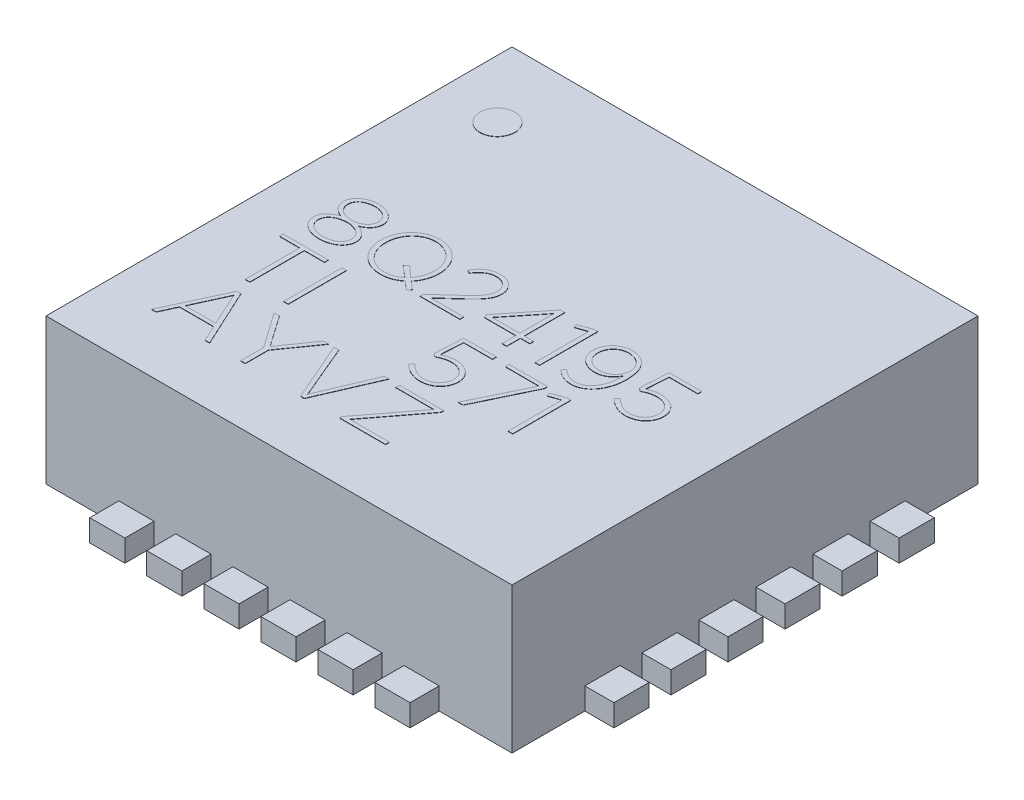
from build123d import *

# Parameters (mm, degrees)
SKETCH1_W           = 4.064
SKETCH1_H           = 4.064
BOSS_EXTRUDE1_DEPTH = 1.27
SKETCH2_W           = 0.306916667
SKETCH2_H           = 0.1905
SKETCH2_W_2         = 0.306916666
BOSS_EXTRUDE2_DEPTH = 0.254
CIRPATTERN1_COUNT   = 4
SKETCH4_R           = 0.1524
SKETCH4_W           = 0.040105263
SKETCH4_H           = 0.508
BOSS_EXTRUDE3_DEPTH = 0.00254


with BuildPart() as part:
    # Sketch1 → Boss-Extrude1 (new body)
    with BuildSketch(Plane(origin=(0, 0, 0), x_dir=(1, 0, 0), z_dir=(0, 1, 0))):
        Rectangle(SKETCH1_W, SKETCH1_H)
    extrude(amount=BOSS_EXTRUDE1_DEPTH)

    # Sketch2 → Boss-Extrude2 (add)
    with BuildSketch(Plane.XY.offset(2.032)):
        with Locations((-1.243541667, 0.09525)):
            Rectangle(SKETCH2_W, SKETCH2_H)
        with Locations((-0.746125, 0.09525)):
            Rectangle(SKETCH2_W_2, SKETCH2_H)
        with Locations((-0.248708334, 0.09525)):
            Rectangle(SKETCH2_W, SKETCH2_H)
        with Locations((0.248708334, 0.09525)):
            Rectangle(SKETCH2_W, SKETCH2_H)
        with Locations((0.746125, 0.09525)):
            Rectangle(SKETCH2_W_2, SKETCH2_H)
        with Locations((1.243541667, 0.09525)):
            Rectangle(SKETCH2_W, SKETCH2_H)
    boss_extrude2 = extrude(amount=BOSS_EXTRUDE2_DEPTH)

    # CirPattern1: Boss-Extrude2 ×4 about axis
    cirpattern1_axis = Axis((0, 0, 0), (0, 1, 0))
    for i in range(1, CIRPATTERN1_COUNT):
        add(boss_extrude2.rotate(cirpattern1_axis, i * 360 / CIRPATTERN1_COUNT))

    # Sketch4 → Boss-Extrude3 (add)
    # profile 1 of 17: a face of its own
    with BuildSketch(Plane(origin=(0, 1.27, 0), x_dir=(1, 0, 0), z_dir=(0, 1, 0))):
        with Locations(Location((-1.524, 1.397, 0), (0, 0, 270))):
            Circle(SKETCH4_R)
    # profile 2 of 17: a face of its own
    with BuildSketch(Plane(origin=(0, 1.27, 0), x_dir=(1, 0, 0), z_dir=(0, 1, 0))):
        with BuildLine():
            add(Edge.make_bspline(
                [(-1.423736842, -0.260684211), (-1.430217677, -0.26057708), (-1.443001851, -0.260365753), (-1.461845793, -0.258293011), (-1.480035947, -0.255093649), (-1.49747682, -0.250636225), (-1.513952921, -0.244903404), (-1.529361644, -0.238070717), (-1.543745325, -0.230384087), (-1.556919764, -0.221592846), (-1.568901469, -0.21188937), (-1.579510899, -0.201143912), (-1.588847464, -0.189563075), (-1.596732267, -0.177070803), (-1.603065091, -0.16377224), (-1.607536203, -0.149682309), (-1.610360564, -0.134910402), (-1.61071469, -0.12481958), (-1.610894737, -0.119689145)],
                knots=[0, 0, 0, 0, 1.192967604, 2.353262652, 3.486248597, 4.591715495, 5.664181549, 6.694533722, 7.692695552, 8.663453221, 9.606576922, 10.526764091, 11.438809736, 12.340523847, 13.240938182, 14.143085136, 15.05589643, 16, 16, 16, 16], degree=3))
            Line((-1.610894737, -0.119689145), (-1.610894737, -0.118226974))
            add(Edge.make_bspline(
                [(-1.610894737, -0.118226974), (-1.610813232, -0.114563141), (-1.610653206, -0.107369563), (-1.608825481, -0.096829022), (-1.606342987, -0.086656264), (-1.602445045, -0.076987385), (-1.597777459, -0.06768054), (-1.592146206, -0.058835412), (-1.586065506, -0.050190355), (-1.578973293, -0.042172116), (-1.571238469, -0.034472338), (-1.562650296, -0.027379175), (-1.553554557, -0.020450602), (-1.540154728, -0.012166679), (-1.522340606, -0.002644683), (-1.507054993, 0.002863842), (-1.499351974, 0.005639803)],
                knots=[0, 0, 0, 0, 0.862348318, 1.693137031, 2.514884982, 3.325335474, 4.14347205, 4.965220001, 5.793940509, 6.631264931, 7.483999692, 8.363157993, 9.254064526, 10.175823288, 12.07284769, 14, 14, 14, 14], degree=3))
            add(Edge.make_bspline(
                [(-1.499351974, 0.005639803), (-1.505748685, 0.00829491), (-1.518586701, 0.013623633), (-1.536656792, 0.023922639), (-1.553154695, 0.036137916), (-1.565435303, 0.047680777), (-1.574073524, 0.057790873), (-1.579764999, 0.065947331), (-1.584927943, 0.074552605), (-1.58943134, 0.083637715), (-1.593178821, 0.093244255), (-1.595582058, 0.103445354), (-1.59725972, 0.114098517), (-1.597436043, 0.121388044), (-1.597526316, 0.125120066)],
                knots=[0, 0, 0, 0, 1.51255183, 3.035648337, 4.531441085, 5.989848776, 6.707803045, 7.433934367, 8.160703137, 8.899047839, 9.647940023, 10.408185517, 11.185038218, 12, 12, 12, 12], degree=3))
            Line((-1.597526316, 0.125120066), (-1.597526316, 0.126582237))
            add(Edge.make_bspline(
                [(-1.597526316, 0.126582237), (-1.597343596, 0.131503545), (-1.596984347, 0.141179391), (-1.59420389, 0.155320205), (-1.589572943, 0.168754397), (-1.583028222, 0.181352575), (-1.575046676, 0.193181991), (-1.565800413, 0.204167549), (-1.555443089, 0.214348674), (-1.543852372, 0.223555765), (-1.53127227, 0.231876646), (-1.517718908, 0.239183623), (-1.503341557, 0.245595721), (-1.488170803, 0.250940497), (-1.472498786, 0.255393957), (-1.456407246, 0.258345879), (-1.440148873, 0.260330557), (-1.429208443, 0.260566306), (-1.423736842, 0.260684211)],
                knots=[0, 0, 0, 0, 0.972639934, 1.912319557, 2.837590777, 3.773556186, 4.711039378, 5.654167378, 6.608311004, 7.578071928, 8.576652838, 9.587028791, 10.619421191, 11.686352778, 12.765320507, 13.837348047, 14.918400104, 16, 16, 16, 16], degree=3))
            add(Edge.make_bspline(
                [(-1.423736842, 0.260684211), (-1.418265239, 0.260566309), (-1.407324805, 0.260330566), (-1.391066464, 0.258345843), (-1.374974804, 0.255394094), (-1.359303236, 0.250939984), (-1.344130837, 0.245597584), (-1.329759376, 0.239176979), (-1.316210318, 0.231914485), (-1.303706915, 0.223486382), (-1.292033264, 0.214389639), (-1.281677671, 0.204161823), (-1.272425843, 0.193183507), (-1.264445773, 0.181352171), (-1.257900659, 0.168754504), (-1.253269817, 0.155320176), (-1.250489331, 0.141179398), (-1.250130087, 0.131503548), (-1.249947368, 0.126582237)],
                knots=[0, 0, 0, 0, 1.081623568, 2.162699283, 3.234750286, 4.313741628, 5.380696565, 6.41311156, 7.423509625, 8.416377007, 9.39154437, 10.345708878, 11.288857519, 12.226361228, 13.162347121, 14.087638591, 15.027338779, 16, 16, 16, 16], degree=3))
            Line((-1.249947368, 0.126582237), (-1.249947368, 0.125120066))
            add(Edge.make_bspline(
                [(-1.249947368, 0.125120066), (-1.250037706, 0.121388085), (-1.250214158, 0.114098636), (-1.251890901, 0.103444909), (-1.254297504, 0.093245877), (-1.258032697, 0.08363179), (-1.262573011, 0.074590089), (-1.267571448, 0.065881), (-1.273418963, 0.057827842), (-1.28202137, 0.047670456), (-1.294331105, 0.036101951), (-1.310893603, 0.023987795), (-1.328902616, 0.013591272), (-1.341720899, 0.008287995), (-1.348121711, 0.005639803)],
                knots=[0, 0, 0, 0, 0.814958338, 1.591807756, 2.352050037, 3.100939056, 3.839280637, 4.562173205, 5.292712271, 6.010663505, 7.469065032, 8.970972537, 10.487454563, 12, 12, 12, 12], degree=3))
            add(Edge.make_bspline(
                [(-1.348121711, 0.005639803), (-1.340416923, 0.002868023), (-1.325156861, -0.00262175), (-1.307389317, -0.012174872), (-1.294018075, -0.020488738), (-1.28483604, -0.027308072), (-1.276341635, -0.034515016), (-1.268590855, -0.042159914), (-1.261534014, -0.050230772), (-1.25529525, -0.058767394), (-1.249828661, -0.067719137), (-1.24511464, -0.076979166), (-1.241269646, -0.086675367), (-1.238613321, -0.096810463), (-1.236830015, -0.107372136), (-1.23666367, -0.11456401), (-1.236578947, -0.118226974)],
                knots=[0, 0, 0, 0, 1.927751522, 3.818094814, 4.740140181, 5.637911092, 6.511079817, 7.36407972, 8.201664492, 9.035462003, 9.853153256, 10.671544216, 11.482246703, 12.30633652, 13.137383551, 14, 14, 14, 14], degree=3))
            Line((-1.236578947, -0.118226974), (-1.236578947, -0.119689145))
            add(Edge.make_bspline(
                [(-1.236578947, -0.119689145), (-1.23677398, -0.124816413), (-1.237157344, -0.134894768), (-1.239766607, -0.149716593), (-1.244448326, -0.163749447), (-1.250729535, -0.177074299), (-1.258629445, -0.189562129), (-1.267961913, -0.201144158), (-1.278572442, -0.211889343), (-1.290553912, -0.221592697), (-1.303728147, -0.23038474), (-1.318112937, -0.23806815), (-1.333547308, -0.244926866), (-1.350073672, -0.250616426), (-1.367508682, -0.255083113), (-1.385661014, -0.258303275), (-1.404472091, -0.260364051), (-1.417256094, -0.260576507), (-1.423736842, -0.260684211)],
                knots=[0, 0, 0, 0, 0.944069567, 1.855699311, 2.75979302, 3.660174925, 4.561856559, 5.473869356, 6.394023383, 7.337113116, 8.307835822, 9.305961701, 10.336276765, 11.414760185, 12.520187268, 13.646822104, 14.807075362, 16, 16, 16, 16], degree=3))
        make_face()
        with BuildLine():
            add(Edge.make_bspline(
                [(-1.423736842, -0.227263158), (-1.418161504, -0.227180457), (-1.407262929, -0.227018794), (-1.391394933, -0.225248844), (-1.376322432, -0.222718251), (-1.362177163, -0.218968398), (-1.348985653, -0.214211552), (-1.336770107, -0.208887057), (-1.325692513, -0.202625008), (-1.315614582, -0.195760937), (-1.30668217, -0.188169336), (-1.298823488, -0.180032332), (-1.292111091, -0.171357818), (-1.286564885, -0.162128525), (-1.282133633, -0.152507903), (-1.279010208, -0.142540642), (-1.277027088, -0.132265773), (-1.276799461, -0.125303189), (-1.276684211, -0.121777961)],
                knots=[0, 0, 0, 0, 1.330333603, 2.60051294, 3.806942895, 4.976101593, 6.088005536, 7.152045264, 8.152972394, 9.121140005, 10.058610309, 10.946126467, 11.817147525, 12.670869761, 13.511343182, 14.339273682, 15.159156879, 16, 16, 16, 16], degree=3))
            Line((-1.276684211, -0.121777961), (-1.276684211, -0.120315789))
            add(Edge.make_bspline(
                [(-1.276684211, -0.120315789), (-1.276833726, -0.116478114), (-1.277129566, -0.108884661), (-1.279218732, -0.097712642), (-1.282948472, -0.087101045), (-1.288001167, -0.077013134), (-1.294288422, -0.06757988), (-1.301552122, -0.058641055), (-1.310044612, -0.050568905), (-1.319525084, -0.043093799), (-1.32992054, -0.036371632), (-1.341207858, -0.030321475), (-1.353410534, -0.02528158), (-1.366368411, -0.021022392), (-1.379925429, -0.017531061), (-1.394080904, -0.015188848), (-1.408734249, -0.013676711), (-1.41868505, -0.013472231), (-1.423736842, -0.013368421)],
                knots=[0, 0, 0, 0, 0.912857224, 1.806233564, 2.691511623, 3.580423748, 4.483156269, 5.383454109, 6.314759265, 7.264153955, 8.251930542, 9.255995273, 10.306530482, 11.388173411, 12.498974, 13.633147632, 14.798403539, 16, 16, 16, 16], degree=3))
            add(Edge.make_bspline(
                [(-1.423736842, -0.013368421), (-1.428788584, -0.01347245), (-1.438739287, -0.013677362), (-1.453393347, -0.015186364), (-1.467579531, -0.017545571), (-1.481177872, -0.021008013), (-1.494142893, -0.025258584), (-1.506289046, -0.030348413), (-1.517554965, -0.036368179), (-1.527946337, -0.043096146), (-1.53743602, -0.050563113), (-1.545912849, -0.058676656), (-1.553301988, -0.067542225), (-1.559561657, -0.077021194), (-1.564660887, -0.087077795), (-1.568222732, -0.097735689), (-1.570352956, -0.108881585), (-1.570642925, -0.116477081), (-1.570789474, -0.120315789)],
                knots=[0, 0, 0, 0, 1.201371395, 2.366409042, 3.500370237, 4.618990472, 5.700430802, 6.743136508, 7.747013171, 8.734604742, 9.683821604, 10.614952321, 11.520360034, 12.422923468, 13.311669095, 14.194104754, 15.08731376, 16, 16, 16, 16], degree=3))
            Line((-1.570789474, -0.120315789), (-1.570789474, -0.121777961))
            add(Edge.make_bspline(
                [(-1.570789474, -0.121777961), (-1.57067714, -0.125304089), (-1.570455274, -0.13226845), (-1.568431643, -0.142520037), (-1.565475608, -0.152528058), (-1.561004907, -0.162126969), (-1.555463983, -0.171352904), (-1.548761253, -0.180073483), (-1.540793093, -0.188097611), (-1.531962919, -0.195798375), (-1.521862091, -0.202649509), (-1.510723205, -0.208858784), (-1.498490405, -0.214216181), (-1.485295837, -0.218967064), (-1.471151446, -0.222718628), (-1.456078696, -0.225248736), (-1.44021077, -0.227018823), (-1.429312186, -0.227180467), (-1.423736842, -0.227263158)],
                knots=[0, 0, 0, 0, 0.840619978, 1.660285594, 2.485532512, 3.325782887, 4.179278562, 5.050068468, 5.943126204, 6.874029178, 7.841939856, 8.849852749, 9.913610101, 11.025218967, 12.194067394, 13.400177186, 14.670019442, 16, 16, 16, 16], degree=3))
        make_face(mode=Mode.SUBTRACT)
        with BuildLine():
            add(Edge.make_bspline(
                [(-1.423736842, 0.020052632), (-1.419276765, 0.020159072), (-1.410437252, 0.020370028), (-1.397378242, 0.021866871), (-1.384671181, 0.024273688), (-1.372366501, 0.02758843), (-1.360638403, 0.031844603), (-1.349590376, 0.03691633), (-1.339211777, 0.042595981), (-1.329688522, 0.049215398), (-1.320984308, 0.056557798), (-1.313119909, 0.064527574), (-1.306396374, 0.073364119), (-1.300510966, 0.082712115), (-1.295769558, 0.092754483), (-1.292443786, 0.103365936), (-1.290371107, 0.114455612), (-1.290159912, 0.12201247), (-1.290052632, 0.125851151)],
                knots=[0, 0, 0, 0, 1.12947462, 2.238527834, 3.324523793, 4.402544155, 5.462455016, 6.480423197, 7.478998997, 8.45489483, 9.412251799, 10.360018837, 11.284153904, 12.218787277, 13.153628582, 14.087804342, 15.028655684, 16, 16, 16, 16], degree=3))
            Line((-1.290052632, 0.125851151), (-1.290052632, 0.127313322))
            add(Edge.make_bspline(
                [(-1.290052632, 0.127313322), (-1.290159704, 0.130909232), (-1.290371391, 0.138018524), (-1.292465474, 0.14843403), (-1.295676366, 0.158413148), (-1.30022534, 0.167865877), (-1.305893287, 0.176723011), (-1.312477307, 0.18501561), (-1.320087299, 0.192611506), (-1.328686679, 0.199458527), (-1.338100087, 0.205747908), (-1.348361883, 0.211314395), (-1.359529987, 0.215962493), (-1.371343068, 0.220023402), (-1.383798434, 0.223293248), (-1.396732236, 0.225502388), (-1.410085345, 0.22709581), (-1.419136514, 0.227206764), (-1.423736842, 0.227263158)],
                knots=[0, 0, 0, 0, 0.929266001, 1.837205292, 2.737247748, 3.635621243, 4.54262191, 5.452702991, 6.369798801, 7.317861578, 8.292088543, 9.295561314, 10.332744225, 11.417933902, 12.525505555, 13.659781721, 14.810565708, 16, 16, 16, 16], degree=3))
            add(Edge.make_bspline(
                [(-1.423736842, 0.227263158), (-1.428337122, 0.227206551), (-1.437388197, 0.227095177), (-1.450741993, 0.22550481), (-1.463706489, 0.223278685), (-1.476202848, 0.220037079), (-1.488025962, 0.215990479), (-1.499155601, 0.211260042), (-1.509455506, 0.205775346), (-1.518888328, 0.199494732), (-1.527391526, 0.192540424), (-1.535106318, 0.185057259), (-1.541681664, 0.176717865), (-1.547344835, 0.167864413), (-1.55193167, 0.158433586), (-1.554975978, 0.148412603), (-1.557111157, 0.138021351), (-1.557316958, 0.130910181), (-1.557421053, 0.127313322)],
                knots=[0, 0, 0, 0, 1.189062478, 2.339486733, 3.473408327, 4.589349186, 5.674199634, 6.702776354, 7.713864404, 8.687786829, 9.628556027, 10.551753839, 11.461550431, 12.368267572, 13.266360238, 14.163369014, 15.071024485, 16, 16, 16, 16], degree=3))
            Line((-1.557421053, 0.127313322), (-1.557421053, 0.125851151))
            add(Edge.make_bspline(
                [(-1.557421053, 0.125851151), (-1.557328733, 0.122009272), (-1.557146838, 0.114439752), (-1.5548582, 0.103400163), (-1.551746549, 0.092730659), (-1.546943106, 0.082721651), (-1.541097329, 0.073322383), (-1.534235642, 0.064598338), (-1.526494802, 0.056522512), (-1.517769687, 0.049182181), (-1.508186464, 0.042663555), (-1.497847663, 0.036850072), (-1.486775702, 0.031902087), (-1.475083418, 0.027560362), (-1.462800362, 0.024279019), (-1.450096028, 0.021865412), (-1.437036281, 0.020370404), (-1.428196868, 0.020159198), (-1.423736842, 0.020052632)],
                knots=[0, 0, 0, 0, 0.971491902, 1.914096394, 2.845788487, 3.780771832, 4.715547213, 5.645233868, 6.587012962, 7.544515391, 8.527822927, 9.51885083, 10.545000554, 11.596786924, 12.674971079, 13.761132045, 14.870353767, 16, 16, 16, 16], degree=3))
        make_face(mode=Mode.SUBTRACT)
    # profile 3 of 17: a face of its own
    with BuildSketch(Plane(origin=(0, 1.27, 0), x_dir=(1, 0, 0), z_dir=(0, 1, 0))):
        with BuildLine():
            add(Edge.make_bspline(
                [(-0.726594572, -0.202928454), (-0.732081662, -0.2073596), (-0.743065608, -0.216229779), (-0.761067116, -0.227491836), (-0.779929913, -0.237537601), (-0.799883862, -0.245885724), (-0.820894501, -0.252482714), (-0.842899441, -0.257313024), (-0.865982647, -0.260161978), (-0.881715983, -0.260507957), (-0.889731086, -0.260684211)],
                knots=[0, 0, 0, 0, 0.95691653, 1.915536321, 2.877681338, 3.856589002, 4.847837564, 5.864099018, 6.911898643, 8, 8, 8, 8], degree=3))
            add(Edge.make_bspline(
                [(-0.889731086, -0.260684211), (-0.899145794, -0.260429652), (-0.917574406, -0.259931373), (-0.944491402, -0.255840665), (-0.970057829, -0.249328076), (-0.994114772, -0.239969395), (-1.016501804, -0.228323578), (-1.037394392, -0.215003999), (-1.056562326, -0.199806431), (-1.074027318, -0.182846961), (-1.089737289, -0.164312752), (-1.103584805, -0.144317067), (-1.115375843, -0.122845513), (-1.125456385, -0.10025574), (-1.133241879, -0.076512802), (-1.138889412, -0.052050728), (-1.14232593, -0.026938756), (-1.142774046, -0.010002119), (-1.143, -0.001462171)],
                knots=[0, 0, 0, 0, 1.117460472, 2.187348085, 3.225110401, 4.244622457, 5.244885452, 6.217313992, 7.182519102, 8.144345375, 9.103467135, 10.063265737, 11.027328158, 12.008260535, 12.99656078, 13.989329521, 14.986161071, 16, 16, 16, 16], degree=3))
            Line((-1.143, -0.001462171), (-1.143, 0))
            add(Edge.make_bspline(
                [(-1.143, 0), (-1.142781841, 0.008540939), (-1.142348181, 0.025518733), (-1.138784032, 0.050662413), (-1.133032818, 0.07524162), (-1.125003388, 0.099082641), (-1.114884937, 0.121940551), (-1.102853222, 0.143510124), (-1.088990714, 0.163701789), (-1.073294772, 0.18241677), (-1.05585935, 0.19962779), (-1.036532322, 0.214911796), (-1.015529676, 0.228326888), (-0.992934503, 0.239848283), (-0.968789904, 0.249200719), (-0.943149467, 0.25587334), (-0.916144027, 0.259916797), (-0.897682725, 0.260425044), (-0.888268914, 0.260684211)],
                knots=[0, 0, 0, 0, 1.00868156, 2.005070874, 2.993722382, 3.987400104, 4.972529166, 5.942874247, 6.901176761, 7.861709682, 8.824388773, 9.790462053, 10.767088875, 11.764046771, 12.782209445, 13.819710371, 14.888224016, 16, 16, 16, 16], degree=3))
            add(Edge.make_bspline(
                [(-0.888268914, 0.260684211), (-0.878959714, 0.260423096), (-0.860672163, 0.259910147), (-0.833906147, 0.255879451), (-0.808419746, 0.249162594), (-0.784334205, 0.239850817), (-0.761736598, 0.228330029), (-0.740765285, 0.214908832), (-0.72144248, 0.199740156), (-0.703977568, 0.182737035), (-0.68825791, 0.164211257), (-0.674429557, 0.144206307), (-0.662562208, 0.122747998), (-0.652728888, 0.100022069), (-0.644731838, 0.076362142), (-0.6391092, 0.051910208), (-0.635673246, 0.02683493), (-0.635225677, 0.009897885), (-0.635, 0.00135773)],
                knots=[0, 0, 0, 0, 1.105207404, 2.17113555, 3.20607169, 4.229564562, 5.231741648, 6.213481224, 7.182047549, 8.143990697, 9.103229002, 10.063144233, 11.027323801, 12.01049879, 13.000223961, 13.989085197, 14.986037876, 16, 16, 16, 16], degree=3))
            add(Edge.make_bspline(
                [(-0.635, 0.00135773), (-0.634791118, 0.001114035), (-0.634373355, 0.000626645), (-0.634791118, 0.000139254), (-0.635, -0.000104441)],
                knots=[0, 0, 0, 0, 1, 2, 2, 2, 2], degree=3))
            add(Edge.make_bspline(
                [(-0.635, -0.000104441), (-0.63518736, -0.008435902), (-0.635558825, -0.024954077), (-0.638938546, -0.049382006), (-0.644258982, -0.073216825), (-0.651665767, -0.096357851), (-0.661046643, -0.118655844), (-0.672477368, -0.139813838), (-0.685827712, -0.159801674), (-0.696216995, -0.171971667), (-0.701424342, -0.178071546)],
                knots=[0, 0, 0, 0, 1.028814904, 2.03975557, 3.040397136, 4.042839456, 5.037352667, 6.024547828, 7.009858051, 8, 8, 8, 8], degree=3))
            Line((-0.701424342, -0.178071546), (-0.629255757, -0.238542763))
            Line((-0.629255757, -0.238542763), (-0.655888158, -0.267368421))
            Line((-0.655888158, -0.267368421), (-0.726594572, -0.202928454))
        make_face()
        with BuildLine():
            add(Edge.make_bspline(
                [(-0.888268914, -0.227263158), (-0.881787166, -0.227090397), (-0.86906103, -0.226751202), (-0.850312159, -0.224436284), (-0.832308524, -0.220466128), (-0.815063424, -0.214903831), (-0.798620484, -0.20798661), (-0.783026242, -0.199835663), (-0.768321342, -0.19045587), (-0.759293601, -0.183236676), (-0.754793586, -0.179638158)],
                knots=[0, 0, 0, 0, 1.075116983, 2.110863481, 3.128091548, 4.128893241, 5.112401198, 6.083625486, 7.044753704, 8, 8, 8, 8], degree=3))
            Line((-0.754793586, -0.179638158), (-0.852445724, -0.095981086))
            Line((-0.852445724, -0.095981086), (-0.825813322, -0.066424342))
            Line((-0.825813322, -0.066424342), (-0.729623355, -0.154363487))
            add(Edge.make_bspline(
                [(-0.729623355, -0.154363487), (-0.725438625, -0.149222881), (-0.717030947, -0.138894722), (-0.706414657, -0.121873782), (-0.696978228, -0.103902358), (-0.689221037, -0.084820424), (-0.682962856, -0.064877695), (-0.678294151, -0.044288338), (-0.675695019, -0.023043825), (-0.675303324, -0.008710056), (-0.675105263, -0.001462171)],
                knots=[0, 0, 0, 0, 0.959237174, 1.927234446, 2.899281412, 3.896530908, 4.906032444, 5.923861561, 6.950198441, 8, 8, 8, 8], degree=3))
            Line((-0.675105263, -0.001462171), (-0.675105263, 0))
            add(Edge.make_bspline(
                [(-0.675105263, 0), (-0.675308753, 0.007704097), (-0.675711796, 0.022963271), (-0.678842875, 0.045476189), (-0.68381163, 0.067355138), (-0.690971459, 0.088349465), (-0.699676785, 0.108405934), (-0.710091039, 0.127201225), (-0.72197075, 0.144714174), (-0.735517017, 0.160709892), (-0.750421113, 0.175320195), (-0.766694438, 0.188439286), (-0.78454276, 0.199709143), (-0.803493895, 0.209562655), (-0.823645517, 0.21756179), (-0.844886827, 0.223183744), (-0.867026244, 0.226598139), (-0.882094741, 0.227039492), (-0.889731086, 0.227263158)],
                knots=[0, 0, 0, 0, 1.061530303, 2.102527649, 3.126824791, 4.149547232, 5.15515158, 6.136678453, 7.106915779, 8.067194349, 9.02067536, 9.97988636, 10.942260631, 11.925170547, 12.920476076, 13.923788185, 14.947826792, 16, 16, 16, 16], degree=3))
            add(Edge.make_bspline(
                [(-0.889731086, 0.227263158), (-0.897366237, 0.227030987), (-0.912392791, 0.226574058), (-0.934468404, 0.223301064), (-0.955585529, 0.217751927), (-0.975637147, 0.209970613), (-0.99454907, 0.200404449), (-1.012125859, 0.188977763), (-1.028450217, 0.176066147), (-1.043316607, 0.161465174), (-1.056727889, 0.145452517), (-1.068542567, 0.128039581), (-1.078839017, 0.109340594), (-1.087450901, 0.089439615), (-1.094395541, 0.068555842), (-1.099232329, 0.04682272), (-1.102430777, 0.02439504), (-1.102738856, 0.009167157), (-1.102894737, 0.001462171)],
                knots=[0, 0, 0, 0, 1.057754835, 2.08174119, 3.084475534, 4.077063908, 5.056495456, 6.015859576, 6.977150046, 7.935689135, 8.897959471, 9.866640835, 10.846820482, 11.851409596, 12.867354005, 13.891306273, 14.9330456, 16, 16, 16, 16], degree=3))
            Line((-1.102894737, 0.001462171), (-1.102894737, 0))
            add(Edge.make_bspline(
                [(-1.102894737, 0), (-1.102690237, -0.007703735), (-1.102285193, -0.022962193), (-1.099168821, -0.045480374), (-1.09414777, -0.067328961), (-1.08719105, -0.088399014), (-1.078287669, -0.108375071), (-1.067926804, -0.12721195), (-1.056012345, -0.144671279), (-1.042595788, -0.160780969), (-1.027577222, -0.175286236), (-1.011281068, -0.188432742), (-0.993486144, -0.199821592), (-0.974526077, -0.209687411), (-0.954330409, -0.217533872), (-0.9331164, -0.223192275), (-0.910972916, -0.22659592), (-0.895904977, -0.227038745), (-0.888268914, -0.227263158)],
                knots=[0, 0, 0, 0, 1.061423812, 2.102316726, 3.126511111, 4.147610346, 5.155046497, 6.136474904, 7.106614896, 8.06371144, 9.020531346, 9.97964612, 10.944515933, 11.927327245, 12.920785011, 13.923996468, 14.947932345, 16, 16, 16, 16], degree=3))
        make_face(mode=Mode.SUBTRACT)
    # profile 4 of 17: a face of its own
    with BuildSketch(Plane(origin=(0, 1.27, 0), x_dir=(1, 0, 0), z_dir=(0, 1, 0))):
        with BuildLine():
            Line((-0.547583059, -0.225696546), (-0.359171875, -0.054726974))
            add(Edge.make_bspline(
                [(-0.359171875, -0.054726974), (-0.354167554, -0.05015925), (-0.344471458, -0.04130908), (-0.330853265, -0.028040969), (-0.318372898, -0.015486013), (-0.307044923, -0.003581903), (-0.296840854, 0.007879037), (-0.287650893, 0.01890065), (-0.279476169, 0.029605583), (-0.272176967, 0.039916582), (-0.266074837, 0.050111809), (-0.260609258, 0.059912813), (-0.256351305, 0.069659434), (-0.251867128, 0.082354322), (-0.248168222, 0.098631734), (-0.247601425, 0.111869278), (-0.247315789, 0.118540296)],
                knots=[0, 0, 0, 0, 1.339194723, 2.594749812, 3.757711961, 4.838337959, 5.842414235, 6.790454929, 7.674069491, 8.504473408, 9.285750938, 10.021678275, 10.721083763, 11.384883482, 12.682120271, 14, 14, 14, 14], degree=3))
            add(Edge.make_bspline(
                [(-0.247315789, 0.118540296), (-0.247457629, 0.122547422), (-0.247737602, 0.130456963), (-0.249306389, 0.142062058), (-0.25248643, 0.153036457), (-0.256495248, 0.163497166), (-0.261628683, 0.173253453), (-0.267519317, 0.182295002), (-0.274081794, 0.190632276), (-0.28157812, 0.198010223), (-0.289621675, 0.204775039), (-0.298458186, 0.21063879), (-0.307987742, 0.215647798), (-0.318109463, 0.219793217), (-0.328588766, 0.22311068), (-0.339336386, 0.225582088), (-0.350296182, 0.226902882), (-0.357671814, 0.227142947), (-0.361365132, 0.227263158)],
                knots=[0, 0, 0, 0, 1.094117954, 2.159645146, 3.185460996, 4.205275291, 5.212441618, 6.187501823, 7.147540828, 8.101542978, 9.052844513, 10.012036881, 10.989547397, 11.986443602, 12.993072009, 13.986521247, 14.991758693, 16, 16, 16, 16], degree=3))
            add(Edge.make_bspline(
                [(-0.361365132, 0.227263158), (-0.365334983, 0.227163202), (-0.373114167, 0.226967331), (-0.384588136, 0.226009149), (-0.395516902, 0.223929896), (-0.40609463, 0.221380428), (-0.416148558, 0.217883013), (-0.425902313, 0.213864171), (-0.435022997, 0.208796465), (-0.446869673, 0.201097551), (-0.46108366, 0.189438603), (-0.477709209, 0.173301019), (-0.494089334, 0.1545228), (-0.504143499, 0.140594368), (-0.50935773, 0.133370888)],
                knots=[0, 0, 0, 0, 0.779588061, 1.527653664, 2.256907532, 2.961369613, 3.661608841, 4.344524681, 5.029591551, 5.706323921, 7.116275394, 8.629062788, 10.251784821, 12, 12, 12, 12], degree=3))
            Line((-0.50935773, 0.133370888), (-0.537452303, 0.15217023))
            add(Edge.make_bspline(
                [(-0.537452303, 0.15217023), (-0.531923555, 0.16022328), (-0.521226306, 0.175804651), (-0.506495165, 0.193902892), (-0.494298699, 0.206950925), (-0.484697599, 0.215727617), (-0.474791251, 0.223940604), (-0.464306805, 0.231354603), (-0.453345106, 0.238079073), (-0.441764469, 0.243926283), (-0.42966037, 0.249102113), (-0.416818165, 0.253253091), (-0.403288578, 0.25662594), (-0.388906603, 0.259037113), (-0.373609147, 0.260346183), (-0.363108184, 0.260569437), (-0.357709704, 0.260684211)],
                knots=[0, 0, 0, 0, 1.85858161, 3.596059891, 4.435023373, 5.255574922, 6.07000447, 6.882599229, 7.697352134, 8.515197398, 9.349543371, 10.200224823, 11.080852807, 12.001285025, 12.972473097, 14, 14, 14, 14], degree=3))
            add(Edge.make_bspline(
                [(-0.357709704, 0.260684211), (-0.352412072, 0.260573169), (-0.341952474, 0.260353928), (-0.326594655, 0.258338546), (-0.31188924, 0.254968069), (-0.297844823, 0.250402976), (-0.284647163, 0.24451584), (-0.272193258, 0.237758565), (-0.260776895, 0.229763449), (-0.250308988, 0.220744913), (-0.240814157, 0.210858637), (-0.232373131, 0.200066931), (-0.22495966, 0.188508646), (-0.218690267, 0.176114581), (-0.213523655, 0.163106464), (-0.209886606, 0.149438535), (-0.207609481, 0.135222898), (-0.207344955, 0.125546538), (-0.207210526, 0.120629112)],
                knots=[0, 0, 0, 0, 1.108687071, 2.188981991, 3.235661581, 4.263598658, 5.275205626, 6.257074869, 7.225543959, 8.186828603, 9.145623371, 10.09040979, 11.050754573, 12.015569309, 12.994105717, 13.97532554, 14.97108155, 16, 16, 16, 16], degree=3))
            Line((-0.207210526, 0.120629112), (-0.207210526, 0.119271382))
            add(Edge.make_bspline(
                [(-0.207210526, 0.119271382), (-0.207281352, 0.114950955), (-0.207421084, 0.106427193), (-0.208812689, 0.093853123), (-0.211122077, 0.081711465), (-0.21427592, 0.069905382), (-0.218359128, 0.05827753), (-0.223673562, 0.046823703), (-0.229803399, 0.03524402), (-0.237219422, 0.023796479), (-0.245488827, 0.012137762), (-0.254857189, 0.000339623), (-0.265139875, -0.011772135), (-0.276672164, -0.024042457), (-0.289269297, -0.036759541), (-0.302885873, -0.05033612), (-0.317757242, -0.064536516), (-0.328141964, -0.074199563), (-0.333479441, -0.079166118)],
                knots=[0, 0, 0, 0, 0.853502812, 1.683874055, 2.496122363, 3.293789465, 4.096690329, 4.927944536, 5.786671486, 6.683649689, 7.620930688, 8.61048053, 9.659622535, 10.759698795, 11.936959445, 13.196886588, 14.559272518, 16, 16, 16, 16], degree=3))
            Line((-0.333479441, -0.079166118), (-0.487947368, -0.220578947))
            Line((-0.487947368, -0.220578947), (-0.200526316, -0.220578947))
            Line((-0.200526316, -0.220578947), (-0.200526316, -0.254))
            Line((-0.200526316, -0.254), (-0.547583059, -0.254))
            Line((-0.547583059, -0.254), (-0.547583059, -0.225696546))
        make_face()
    # profile 5 of 17: a face of its own
    with BuildSketch(Plane(origin=(0, 1.27, 0), x_dir=(1, 0, 0), z_dir=(0, 1, 0))):
        Polygon((0.167105263, -0.133684211), (-0.106529605, -0.133684211), (-0.119480263, -0.105380757), (0.169507401, 0.254), (0.207210526, 0.254), (0.207210526, -0.100263158), (0.289509868, -0.100263158), (0.289509868, -0.133684211), (0.207210526, -0.133684211), (0.207210526, -0.254), (0.167105263, -0.254), align=None)
        Polygon((0.167105263, -0.100263158), (0.167105263, 0.198646382), (-0.07404852, -0.100263158), align=None, mode=Mode.SUBTRACT)
    # profile 6 of 17: a face of its own
    with BuildSketch(Plane(origin=(0, 1.27, 0), x_dir=(1, 0, 0), z_dir=(0, 1, 0))):
        Polygon((0.454526316, 0.215043586), (0.357083059, 0.181831414), (0.346952303, 0.211388158), (0.463194901, 0.254), (0.494631579, 0.254), (0.494631579, -0.254), (0.454526316, -0.254), align=None)
    # profile 7 of 17: a face of its own
    with BuildSketch(Plane(origin=(0, 1.27, 0), x_dir=(1, 0, 0), z_dir=(0, 1, 0))):
        with BuildLine():
            add(Edge.make_bspline(
                [(0.774219572, -0.260684211), (0.766512619, -0.260468973), (0.751475797, -0.260049028), (0.729621174, -0.256620768), (0.709118324, -0.251166851), (0.690017596, -0.243258063), (0.672108782, -0.233568296), (0.654691167, -0.223051279), (0.637938812, -0.211320434), (0.62729382, -0.202746), (0.621944901, -0.1984375)],
                knots=[0, 0, 0, 0, 1.09895189, 2.144134415, 3.147733063, 4.118893565, 5.085318409, 6.050364033, 7.020342788, 8, 8, 8, 8], degree=3))
            Line((0.621944901, -0.1984375), (0.645757401, -0.169507401))
            add(Edge.make_bspline(
                [(0.645757401, -0.169507401), (0.651091029, -0.174110299), (0.661423804, -0.18302744), (0.677483759, -0.194739922), (0.693272353, -0.204719034), (0.708941341, -0.213055502), (0.724878718, -0.219389579), (0.741158784, -0.223889355), (0.757898388, -0.226716099), (0.769230172, -0.227079637), (0.774950658, -0.227263158)],
                knots=[0, 0, 0, 0, 1.166672397, 2.260180855, 3.289015566, 4.25892832, 5.195982641, 6.123637376, 7.05277881, 8, 8, 8, 8], degree=3))
            add(Edge.make_bspline(
                [(0.774950658, -0.227263158), (0.781200124, -0.227019776), (0.793564006, -0.226538271), (0.811643292, -0.222776342), (0.828886695, -0.216643998), (0.845259871, -0.208129473), (0.86052172, -0.197321818), (0.874795375, -0.184685027), (0.887715986, -0.170053361), (0.899589389, -0.153680657), (0.910098606, -0.135508022), (0.919143247, -0.115629661), (0.927017805, -0.09424347), (0.933427414, -0.071258624), (0.938471605, -0.046880673), (0.941643368, -0.02121469), (0.94316638, 0.005589537), (0.942707689, 0.023811589), (0.942473684, 0.03310773)],
                knots=[0, 0, 0, 0, 0.867952769, 1.717149156, 2.554185777, 3.404594082, 4.272991703, 5.146857209, 6.048045, 6.979979854, 7.953339853, 8.959954231, 10.011501689, 11.117329598, 12.273003272, 13.467773553, 14.708162134, 16, 16, 16, 16], degree=3))
            add(Edge.make_bspline(
                [(0.942473684, 0.03310773), (0.938740439, 0.026515373), (0.931213067, 0.013223149), (0.919770939, -0.00218552), (0.909674741, -0.013863935), (0.901499847, -0.022160131), (0.892737214, -0.029867644), (0.88340891, -0.03702387), (0.873466378, -0.043467923), (0.863003672, -0.049374176), (0.851889143, -0.054486693), (0.840201082, -0.058859076), (0.827907544, -0.06250238), (0.814920692, -0.064917367), (0.801311929, -0.06656722), (0.792014466, -0.066749288), (0.787274671, -0.066842105)],
                knots=[0, 0, 0, 0, 1.633064954, 3.292762144, 4.128493712, 4.962198443, 5.802875112, 6.643987704, 7.495892772, 8.356589936, 9.23354678, 10.131819618, 11.046793933, 11.99526999, 12.977999713, 14, 14, 14, 14], degree=3))
            add(Edge.make_bspline(
                [(0.787274671, -0.066842105), (0.781104116, -0.066719946), (0.768962287, -0.066479573), (0.751159768, -0.06403729), (0.734060315, -0.060499943), (0.717853367, -0.055225961), (0.702595838, -0.048642642), (0.688372151, -0.040909814), (0.675164459, -0.032100838), (0.663205999, -0.022072959), (0.652370426, -0.011073878), (0.642833331, 0.000930974), (0.634443562, 0.013765452), (0.627434766, 0.027484301), (0.621863417, 0.041933427), (0.617935826, 0.056999813), (0.615426725, 0.072607402), (0.615108699, 0.083194883), (0.614947368, 0.088565789)],
                knots=[0, 0, 0, 0, 1.142854509, 2.248800132, 3.324407685, 4.375173688, 5.401084946, 6.400004354, 7.371653371, 8.338147944, 9.287105371, 10.228200474, 11.174852231, 12.124160507, 13.077908967, 14.038766695, 15.005088979, 16, 16, 16, 16], degree=3))
            Line((0.614947368, 0.088565789), (0.614947368, 0.090027961))
            add(Edge.make_bspline(
                [(0.614947368, 0.090027961), (0.615113474, 0.095780287), (0.615442116, 0.107161354), (0.617901897, 0.124000152), (0.622006926, 0.140358111), (0.627634808, 0.156202924), (0.634701049, 0.171334502), (0.643203347, 0.185486337), (0.65298684, 0.198620884), (0.663987088, 0.210770765), (0.676166065, 0.221881021), (0.689666376, 0.231577852), (0.704132758, 0.240214329), (0.719717333, 0.247537001), (0.736370668, 0.253381776), (0.753952662, 0.25768338), (0.772474125, 0.260223776), (0.785108299, 0.260528619), (0.791556743, 0.260684211)],
                knots=[0, 0, 0, 0, 1.007145394, 1.992652489, 2.973016653, 3.956466024, 4.932879082, 5.892725135, 6.842605771, 7.79652793, 8.75906163, 9.723678405, 10.702353905, 11.706024079, 12.733774052, 13.788088757, 14.871047239, 16, 16, 16, 16], degree=3))
            add(Edge.make_bspline(
                [(0.791556743, 0.260684211), (0.79821725, 0.260553591), (0.811214261, 0.260298706), (0.830092395, 0.257446802), (0.847884866, 0.253168841), (0.864425434, 0.246867156), (0.879938974, 0.239390597), (0.894239435, 0.23054128), (0.907570865, 0.220775136), (0.915464215, 0.21325203), (0.91939227, 0.209508224)],
                knots=[0, 0, 0, 0, 1.129461473, 2.203980053, 3.232843748, 4.229304981, 5.201707126, 6.15116916, 7.079946018, 8, 8, 8, 8], degree=3))
            add(Edge.make_bspline(
                [(0.91939227, 0.209508224), (0.924105626, 0.20449109), (0.933691695, 0.194287195), (0.943952922, 0.179821167), (0.951404385, 0.167218443), (0.956766531, 0.15706079), (0.961414159, 0.146070746), (0.965793467, 0.13451338), (0.969865487, 0.1222193), (0.973081401, 0.10905807), (0.976062034, 0.095140452), (0.978434245, 0.080392964), (0.980296058, 0.064818267), (0.981684789, 0.048343312), (0.98234798, 0.030954716), (0.982500785, 0.019043436), (0.982578947, 0.012950658)],
                knots=[0, 0, 0, 0, 1.36139999, 2.768828395, 3.497984668, 4.259254587, 5.040107438, 5.857909503, 6.705590199, 7.601394472, 8.537960698, 9.522405295, 10.556599683, 11.642158021, 12.793932454, 14, 14, 14, 14], degree=3))
            Line((0.982578947, 0.012950658), (0.982578947, 0.011488487))
            add(Edge.make_bspline(
                [(0.982578947, 0.011488487), (0.982390499, 0.001731121), (0.982020667, -0.017417781), (0.978755823, -0.045481062), (0.973777805, -0.072354901), (0.966357668, -0.097790821), (0.957454647, -0.121793319), (0.946925506, -0.144195497), (0.935074649, -0.164982827), (0.921811867, -0.18408304), (0.9071656, -0.201238072), (0.89133142, -0.21651948), (0.874248642, -0.22973442), (0.856057112, -0.24085192), (0.836828107, -0.24970688), (0.816708846, -0.25610362), (0.795709624, -0.259984295), (0.781442344, -0.26044897), (0.774219572, -0.260684211)],
                knots=[0, 0, 0, 0, 1.230334843, 2.414541162, 3.559109368, 4.673795971, 5.752078941, 6.78536801, 7.79245963, 8.767011231, 9.71389417, 10.633188142, 11.537882254, 12.4325779, 13.316791413, 14.201440982, 15.089484443, 16, 16, 16, 16], degree=3))
        make_face()
        with BuildLine():
            add(Edge.make_bspline(
                [(0.793645559, -0.033421053), (0.798978957, -0.033278446), (0.809409406, -0.032999551), (0.824672004, -0.030878062), (0.839100691, -0.027362037), (0.852643338, -0.022390613), (0.865280834, -0.016332881), (0.876964437, -0.009332759), (0.887755342, -0.00153585), (0.897582584, 0.007108397), (0.906308753, 0.016604559), (0.914037549, 0.026721534), (0.920616875, 0.037468773), (0.926012372, 0.048804634), (0.930465126, 0.060402607), (0.933413872, 0.07226842), (0.935444527, 0.084179411), (0.935674247, 0.09217795), (0.935789474, 0.096189967)],
                knots=[0, 0, 0, 0, 1.197747958, 2.342418122, 3.453882716, 4.5275646, 5.576905283, 6.597528683, 7.583002742, 8.563655548, 9.532134433, 10.475275837, 11.419486544, 12.356871777, 13.292297727, 14.20462154, 15.099449471, 16, 16, 16, 16], degree=3))
            Line((0.935789474, 0.096189967), (0.935789474, 0.097652138))
            add(Edge.make_bspline(
                [(0.935789474, 0.097652138), (0.935633215, 0.102080069), (0.935324057, 0.110840755), (0.933332503, 0.123784884), (0.929850812, 0.136281004), (0.925008845, 0.148289279), (0.919083387, 0.159715537), (0.912155702, 0.170506245), (0.904086019, 0.180404882), (0.895020981, 0.189557907), (0.885042782, 0.197934016), (0.87392839, 0.205268434), (0.861910083, 0.211746627), (0.848943048, 0.217273356), (0.835248753, 0.221732926), (0.820895164, 0.225030602), (0.805984872, 0.226899945), (0.795843851, 0.22714126), (0.790721217, 0.227263158)],
                knots=[0, 0, 0, 0, 0.980656696, 1.940234716, 2.892349928, 3.847301653, 4.802502339, 5.739196388, 6.682026122, 7.625202561, 8.588675414, 9.561633884, 10.568933392, 11.608641031, 12.678999484, 13.754455175, 14.865685777, 16, 16, 16, 16], degree=3))
            add(Edge.make_bspline(
                [(0.790721217, 0.227263158), (0.785596559, 0.227120438), (0.775581774, 0.226841531), (0.760939644, 0.224725232), (0.747110097, 0.221180105), (0.734133344, 0.216263311), (0.722091626, 0.210130224), (0.710872171, 0.203192639), (0.700672887, 0.195142393), (0.691360694, 0.186299096), (0.683089984, 0.1765451), (0.675867932, 0.166019978), (0.669520979, 0.154802033), (0.664404053, 0.142823786), (0.660168591, 0.130450531), (0.6572843, 0.117738366), (0.655429618, 0.104843475), (0.655178621, 0.096161442), (0.655052632, 0.091803454)],
                knots=[0, 0, 0, 0, 1.149457013, 2.246309, 3.310957911, 4.346707444, 5.352697443, 6.338750924, 7.301229249, 8.2624708, 9.215554207, 10.164500098, 11.122658651, 12.10210102, 13.08266389, 14.052718415, 15.022552806, 16, 16, 16, 16], degree=3))
            Line((0.655052632, 0.091803454), (0.655052632, 0.090341283))
            add(Edge.make_bspline(
                [(0.655052632, 0.090341283), (0.655172178, 0.085948742), (0.65540766, 0.077296374), (0.657299307, 0.064566981), (0.660604905, 0.05242001), (0.664919887, 0.040776571), (0.670634644, 0.029900474), (0.677341714, 0.019710205), (0.685087649, 0.010266106), (0.693910957, 0.001689538), (0.703661358, -0.006039938), (0.714254687, -0.012964507), (0.725675554, -0.018981882), (0.737799973, -0.024302752), (0.750771884, -0.028319053), (0.764435829, -0.031248102), (0.778801609, -0.033057716), (0.788627074, -0.033298215), (0.793645559, -0.033421053)],
                knots=[0, 0, 0, 0, 1.014744419, 1.998829498, 2.964728541, 3.919441268, 4.862114519, 5.796963762, 6.734267181, 7.678586545, 8.634653956, 9.605231474, 10.598480164, 11.614626604, 12.660307295, 13.730062824, 14.840599607, 16, 16, 16, 16], degree=3))
        make_face(mode=Mode.SUBTRACT)
    # profile 8 of 17: a face of its own
    with BuildSketch(Plane(origin=(0, 1.27, 0), x_dir=(1, 0, 0), z_dir=(0, 1, 0))):
        with BuildLine():
            add(Edge.make_bspline(
                [(1.246396382, -0.260684211), (1.237848045, -0.260409061), (1.220915334, -0.259864038), (1.195899316, -0.255307749), (1.171690275, -0.247871788), (1.148464605, -0.23755934), (1.126512315, -0.225127967), (1.105900611, -0.211354258), (1.086826764, -0.196290725), (1.075304566, -0.185166706), (1.069578125, -0.179638158)],
                knots=[0, 0, 0, 0, 1.027091986, 2.034483686, 3.045944865, 4.065436139, 5.082966719, 6.075467794, 7.043522885, 8, 8, 8, 8], degree=3))
            Line((1.069578125, -0.179638158), (1.096314967, -0.152901316))
            add(Edge.make_bspline(
                [(1.096314967, -0.152901316), (1.102076258, -0.158465315), (1.113397947, -0.1693993), (1.131577564, -0.183837229), (1.149975316, -0.196731205), (1.168846196, -0.207601588), (1.188086776, -0.21643022), (1.207775865, -0.222574069), (1.227716265, -0.226543786), (1.241156138, -0.227023784), (1.247858553, -0.227263158)],
                knots=[0, 0, 0, 0, 1.109179193, 2.17968211, 3.212685538, 4.219648281, 5.193340946, 6.139214123, 7.072032972, 8, 8, 8, 8], degree=3))
            add(Edge.make_bspline(
                [(1.247858553, -0.227263158), (1.25280728, -0.227137706), (1.26252826, -0.226891277), (1.276764363, -0.22510498), (1.290315171, -0.222105035), (1.303085125, -0.217768259), (1.31508747, -0.212475607), (1.326227501, -0.206196399), (1.336427347, -0.19892656), (1.345747731, -0.190783681), (1.354103167, -0.181727974), (1.361648657, -0.172055118), (1.368182282, -0.161587896), (1.373726975, -0.150448441), (1.378071549, -0.13863338), (1.38137215, -0.126381983), (1.38327325, -0.113656462), (1.383511235, -0.105038746), (1.383631579, -0.100680921)],
                knots=[0, 0, 0, 0, 1.145346535, 2.249849336, 3.315357495, 4.352544201, 5.366331399, 6.347897687, 7.307179358, 8.260859585, 9.207397063, 10.155202969, 11.096546173, 12.058801949, 13.030293121, 14.005687019, 14.991511462, 16, 16, 16, 16], degree=3))
            Line((1.383631579, -0.100680921), (1.383631579, -0.099323191))
            add(Edge.make_bspline(
                [(1.383631579, -0.099323191), (1.383512452, -0.095069543), (1.383277877, -0.086693565), (1.38138145, -0.074380903), (1.378090049, -0.062642551), (1.373711741, -0.051429322), (1.36817892, -0.040824406), (1.361425673, -0.03102102), (1.353812035, -0.021843274), (1.34504539, -0.013597811), (1.335422384, -0.006043226), (1.324836351, 0.000670453), (1.313259658, 0.006404411), (1.300882528, 0.011261378), (1.287810634, 0.015287033), (1.274065056, 0.018070863), (1.259739179, 0.019786554), (1.249987084, 0.019963066), (1.245038651, 0.020052632)],
                knots=[0, 0, 0, 0, 0.997445971, 1.964098809, 2.913068328, 3.851722655, 4.783138491, 5.711758029, 6.63915603, 7.574857543, 8.528837996, 9.505237224, 10.509512245, 11.554302971, 12.621166842, 13.713386878, 14.839721157, 16, 16, 16, 16], degree=3))
            add(Edge.make_bspline(
                [(1.245038651, 0.020052632), (1.239291255, 0.019916862), (1.228119684, 0.019652959), (1.21181893, 0.018053595), (1.196565096, 0.014995534), (1.177775859, 0.009535126), (1.155780455, 0.000941015), (1.13917596, -0.007523861), (1.130989309, -0.011697368)],
                knots=[0, 0, 0, 0, 0.864106721, 1.679617632, 2.458643664, 3.199094088, 4.619046371, 6, 6, 6, 6], degree=3))
            Line((1.130989309, -0.011697368), (1.102059211, 0.006997533))
            Line((1.102059211, 0.006997533), (1.116472039, 0.254))
            Line((1.116472039, 0.254), (1.400759868, 0.254))
            Line((1.400759868, 0.254), (1.400759868, 0.220578947))
            Line((1.400759868, 0.220578947), (1.149684211, 0.220578947))
            Line((1.149684211, 0.220578947), (1.137464638, 0.02642352))
            add(Edge.make_bspline(
                [(1.137464638, 0.02642352), (1.145683354, 0.03024262), (1.162064724, 0.03785477), (1.183679483, 0.044978077), (1.201769486, 0.049622803), (1.216614996, 0.051741026), (1.232575849, 0.053325811), (1.243606677, 0.053423224), (1.249320724, 0.053473684)],
                knots=[0, 0, 0, 0, 1.402637683, 2.795707893, 3.517593015, 4.292393027, 5.115447508, 6, 6, 6, 6], degree=3))
            add(Edge.make_bspline(
                [(1.249320724, 0.053473684), (1.25534996, 0.053330759), (1.267236124, 0.053048993), (1.284699379, 0.050895105), (1.301503818, 0.047525225), (1.317487098, 0.042511898), (1.33273154, 0.036550668), (1.34699143, 0.029274646), (1.360321215, 0.021014896), (1.372666913, 0.011692379), (1.384054267, 0.001411436), (1.393934814, -0.010219481), (1.402833874, -0.022646176), (1.410178891, -0.036187921), (1.41635671, -0.05046123), (1.420573111, -0.065642619), (1.423310426, -0.081503672), (1.423593145, -0.092348793), (1.423736842, -0.09786102)],
                knots=[0, 0, 0, 0, 1.123273924, 2.214445758, 3.274310636, 4.312692179, 5.33188634, 6.321261941, 7.291587211, 8.25045863, 9.200953541, 10.143890608, 11.088878704, 12.044166038, 13.009337543, 13.980681618, 14.973645425, 16, 16, 16, 16], degree=3))
            Line((1.423736842, -0.09786102), (1.423736842, -0.099323191))
            add(Edge.make_bspline(
                [(1.423736842, -0.099323191), (1.423593717, -0.105182817), (1.423312785, -0.116684357), (1.420586857, -0.133483952), (1.416356659, -0.149524556), (1.410209698, -0.164613577), (1.402837758, -0.178901264), (1.393956073, -0.192074914), (1.384010865, -0.204428069), (1.37272868, -0.215650675), (1.360347326, -0.225821997), (1.346923747, -0.23489036), (1.332310904, -0.242567152), (1.316805347, -0.249197323), (1.300302337, -0.254268326), (1.283059011, -0.258064074), (1.264974927, -0.260277455), (1.25266884, -0.260546882), (1.246396382, -0.260684211)],
                knots=[0, 0, 0, 0, 1.04914212, 2.05930394, 3.041340515, 4.015500302, 4.972493289, 5.917106832, 6.857219733, 7.80995437, 8.762791105, 9.724711486, 10.706985765, 11.716087755, 12.742015645, 13.795469643, 14.876342745, 16, 16, 16, 16], degree=3))
        make_face()
    # profile 9 of 17: a face of its own
    with BuildSketch(Plane(origin=(0, 1.27, 0), x_dir=(1, 0, 0), z_dir=(0, 1, 0))):
        Polygon((-1.437105263, -0.414421053), (-1.613296875, -0.414421053), (-1.613296875, -0.381), (-1.220808388, -0.381), (-1.220808388, -0.414421053), (-1.397, -0.414421053), (-1.397, -0.889), (-1.437105263, -0.889), align=None)
    # profile 10 of 17: a face of its own
    with BuildSketch(Plane(origin=(0, 1.27, 0), x_dir=(1, 0, 0), z_dir=(0, 1, 0))):
        with Locations((-1.082842106, -0.635)):
            Rectangle(SKETCH4_W, SKETCH4_H)
    # profile 11 of 17: a face of its own
    with BuildSketch(Plane(origin=(0, 1.27, 0), x_dir=(1, 0, 0), z_dir=(0, 1, 0))):
        with BuildLine():
            add(Edge.make_bspline(
                [(0.090027961, -0.895684211), (0.081479624, -0.895409061), (0.064546912, -0.894864038), (0.039530895, -0.890307749), (0.015321854, -0.882871788), (-0.007903816, -0.87255934), (-0.029856106, -0.860127967), (-0.05046781, -0.846354258), (-0.069541657, -0.831290725), (-0.081063856, -0.820166706), (-0.086790296, -0.814638158)],
                knots=[0, 0, 0, 0, 1.027091986, 2.034483686, 3.045944865, 4.065436139, 5.082966719, 6.075467794, 7.043522885, 8, 8, 8, 8], degree=3))
            Line((-0.086790296, -0.814638158), (-0.060053454, -0.787901316))
            add(Edge.make_bspline(
                [(-0.060053454, -0.787901316), (-0.054292163, -0.793465315), (-0.042970474, -0.8043993), (-0.024790857, -0.818837229), (-0.006393105, -0.831731205), (0.012477775, -0.842601588), (0.031718355, -0.85143022), (0.051407444, -0.857574069), (0.071347844, -0.861543786), (0.084787717, -0.862023784), (0.091490132, -0.862263158)],
                knots=[0, 0, 0, 0, 1.109179193, 2.17968211, 3.212685538, 4.219648281, 5.193340946, 6.139214123, 7.072032972, 8, 8, 8, 8], degree=3))
            add(Edge.make_bspline(
                [(0.091490132, -0.862263158), (0.096438859, -0.862137706), (0.106159839, -0.861891277), (0.120395942, -0.86010498), (0.13394675, -0.857105035), (0.146716703, -0.852768259), (0.158719049, -0.847475607), (0.16985908, -0.841196399), (0.180058926, -0.83392656), (0.18937931, -0.825783681), (0.197734745, -0.816727974), (0.205280236, -0.807055118), (0.211813861, -0.796587896), (0.217358554, -0.785448441), (0.221703128, -0.77363338), (0.225003729, -0.761381983), (0.226904829, -0.748656462), (0.227142814, -0.740038746), (0.227263158, -0.735680921)],
                knots=[0, 0, 0, 0, 1.145346535, 2.249849336, 3.315357495, 4.352544201, 5.366331399, 6.347897687, 7.307179358, 8.260859585, 9.207397063, 10.155202969, 11.096546173, 12.058801949, 13.030293121, 14.005687019, 14.991511462, 16, 16, 16, 16], degree=3))
            Line((0.227263158, -0.735680921), (0.227263158, -0.734323191))
            add(Edge.make_bspline(
                [(0.227263158, -0.734323191), (0.227144031, -0.730069543), (0.226909456, -0.721693565), (0.225013029, -0.709380903), (0.221721627, -0.697642551), (0.21734332, -0.686429322), (0.211810499, -0.675824406), (0.205057252, -0.66602102), (0.197443614, -0.656843274), (0.188676969, -0.648597811), (0.179053963, -0.641043226), (0.16846793, -0.634329547), (0.156891237, -0.628595589), (0.144514107, -0.623738622), (0.131442213, -0.619712967), (0.117696635, -0.616929137), (0.103370758, -0.615213446), (0.093618662, -0.615036934), (0.08867023, -0.614947368)],
                knots=[0, 0, 0, 0, 0.997445971, 1.964098809, 2.913068328, 3.851722655, 4.783138491, 5.711758029, 6.63915603, 7.574857543, 8.528837996, 9.505237224, 10.509512245, 11.554302971, 12.621166842, 13.713386878, 14.839721157, 16, 16, 16, 16], degree=3))
            add(Edge.make_bspline(
                [(0.08867023, -0.614947368), (0.082922834, -0.615083138), (0.071751263, -0.615347041), (0.055450509, -0.616946405), (0.040196675, -0.620004466), (0.021407438, -0.625464874), (-0.000587966, -0.634058985), (-0.017192461, -0.642523861), (-0.025379112, -0.646697368)],
                knots=[0, 0, 0, 0, 0.864106721, 1.679617632, 2.458643664, 3.199094088, 4.619046371, 6, 6, 6, 6], degree=3))
            Line((-0.025379112, -0.646697368), (-0.054309211, -0.628002467))
            Line((-0.054309211, -0.628002467), (-0.039896382, -0.381))
            Line((-0.039896382, -0.381), (0.244391447, -0.381))
            Line((0.244391447, -0.381), (0.244391447, -0.414421053))
            Line((0.244391447, -0.414421053), (-0.006684211, -0.414421053))
            Line((-0.006684211, -0.414421053), (-0.018903783, -0.60857648))
            add(Edge.make_bspline(
                [(-0.018903783, -0.60857648), (-0.010685068, -0.60475738), (0.005696303, -0.59714523), (0.027311062, -0.590021923), (0.045401065, -0.585377197), (0.060246575, -0.583258974), (0.076207428, -0.581674189), (0.087238256, -0.581576776), (0.092952303, -0.581526316)],
                knots=[0, 0, 0, 0, 1.402637683, 2.795707893, 3.517593015, 4.292393027, 5.115447508, 6, 6, 6, 6], degree=3))
            add(Edge.make_bspline(
                [(0.092952303, -0.581526316), (0.098981539, -0.581669241), (0.110867703, -0.581951007), (0.128330958, -0.584104895), (0.145135397, -0.587474775), (0.161118677, -0.592488102), (0.176363119, -0.598449332), (0.190623009, -0.605725354), (0.203952794, -0.613985104), (0.216298492, -0.623307621), (0.227685846, -0.633588564), (0.237566393, -0.645219481), (0.246465453, -0.657646176), (0.25381047, -0.671187921), (0.259988289, -0.68546123), (0.26420469, -0.700642619), (0.266942004, -0.716503672), (0.267224724, -0.727348793), (0.267368421, -0.73286102)],
                knots=[0, 0, 0, 0, 1.123273924, 2.214445758, 3.274310636, 4.312692179, 5.33188634, 6.321261941, 7.291587211, 8.25045863, 9.200953541, 10.143890608, 11.088878704, 12.044166038, 13.009337543, 13.980681618, 14.973645425, 16, 16, 16, 16], degree=3))
            Line((0.267368421, -0.73286102), (0.267368421, -0.734323191))
            add(Edge.make_bspline(
                [(0.267368421, -0.734323191), (0.267225296, -0.740182817), (0.266944364, -0.751684357), (0.264218436, -0.768483952), (0.259988238, -0.784524556), (0.253841277, -0.799613577), (0.246469337, -0.813901264), (0.237587652, -0.827074914), (0.227642444, -0.839428069), (0.216360259, -0.850650675), (0.203978905, -0.860821997), (0.190555326, -0.86989036), (0.175942483, -0.877567152), (0.160436926, -0.884197323), (0.143933916, -0.889268326), (0.12669059, -0.893064074), (0.108606506, -0.895277455), (0.096300418, -0.895546882), (0.090027961, -0.895684211)],
                knots=[0, 0, 0, 0, 1.04914212, 2.05930394, 3.041340515, 4.015500302, 4.972493289, 5.917106832, 6.857219733, 7.80995437, 8.762791105, 9.724711486, 10.706985765, 11.716087755, 12.742015645, 13.795469643, 14.876342745, 16, 16, 16, 16], degree=3))
        make_face()
    # profile 12 of 17: a face of its own
    with BuildSketch(Plane(origin=(0, 1.27, 0), x_dir=(1, 0, 0), z_dir=(0, 1, 0))):
        Polygon((0.649621711, -0.414421053), (0.356560855, -0.414421053), (0.356560855, -0.381), (0.691502467, -0.381), (0.691502467, -0.408572368), (0.461210526, -0.889), (0.420060855, -0.889), align=None)
    # profile 13 of 17: a face of its own
    with BuildSketch(Plane(origin=(0, 1.27, 0), x_dir=(1, 0, 0), z_dir=(0, 1, 0))):
        Polygon((0.855578947, -0.419956414), (0.758135691, -0.453168586), (0.748004934, -0.423611842), (0.864247533, -0.381), (0.895684211, -0.381), (0.895684211, -0.889), (0.855578947, -0.889), align=None)
    # profile 14 of 17: a face of its own
    with BuildSketch(Plane(origin=(0, 1.27, 0), x_dir=(1, 0, 0), z_dir=(0, 1, 0))):
        Polygon((-1.383944901, -1.016), (-1.347808388, -1.016), (-1.112503289, -1.524), (-1.153652961, -1.524), (-1.217884046, -1.383631579), (-1.515958059, -1.383631579), (-1.580293586, -1.524), (-1.61925, -1.524), align=None)
        Polygon((-1.233759046, -1.350210526), (-1.36660773, -1.057880757), (-1.500083059, -1.350210526), align=None, mode=Mode.SUBTRACT)
    # profile 15 of 17: a face of its own
    with BuildSketch(Plane(origin=(0, 1.27, 0), x_dir=(1, 0, 0), z_dir=(0, 1, 0))):
        Polygon((-0.842210526, -1.32295148), (-1.058820724, -1.016), (-1.011926809, -1.016), (-0.821426809, -1.288903783), (-0.630300164, -1.016), (-0.585495066, -1.016), (-0.802105263, -1.322220395), (-0.802105263, -1.524), (-0.842210526, -1.524), align=None)
    # profile 16 of 17: a face of its own
    with BuildSketch(Plane(origin=(0, 1.27, 0), x_dir=(1, 0, 0), z_dir=(0, 1, 0))):
        Polygon((-0.536407895, -1.016), (-0.494527138, -1.016), (-0.296716283, -1.486192434), (-0.098174342, -1.016), (-0.058486842, -1.016), (-0.280841283, -1.530684211), (-0.314053454, -1.530684211), align=None)
    # profile 17 of 17: a face of its own
    with BuildSketch(Plane(origin=(0, 1.27, 0), x_dir=(1, 0, 0), z_dir=(0, 1, 0))):
        Polygon((0.022350329, -1.502902961), (0.368153783, -1.049421053), (0.034674342, -1.049421053), (0.034674342, -1.016), (0.421523026, -1.016), (0.421523026, -1.037097039), (0.075824013, -1.490578947), (0.421523026, -1.490578947), (0.421523026, -1.524), (0.022350329, -1.524), align=None)
    extrude(amount=BOSS_EXTRUDE3_DEPTH)


solid = part.part
